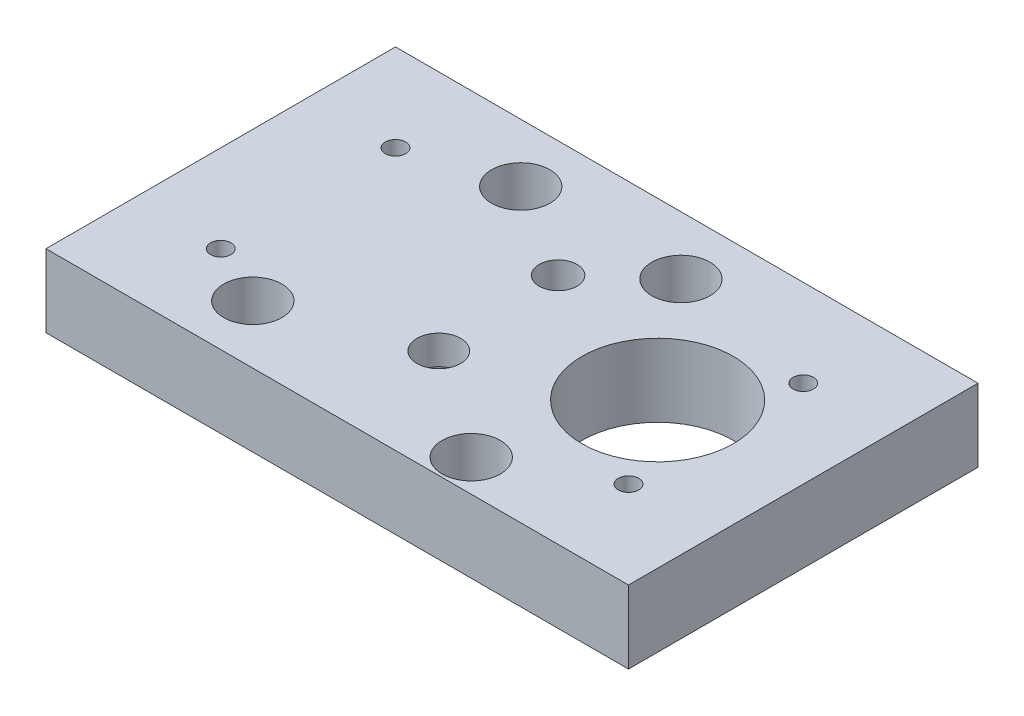
from build123d import *

# Parameters (mm, degrees)
SKETCH_1_W          = 20
SKETCH_1_H          = 12
SKETCH_1_R          = 0.65
SKETCH_1_R_2        = 1.6
SKETCH_1_R_3        = 2.6
EXTRUDE_1_DEPTH     = 2.5
EXTRUDE_START       = 1.5
SKETCH_1_5_R        = 1.6
SKETCH_1_5_R_2      = 0.75
EXTRUDE_2_DEPTH     = 1
SKETCH_3_R          = 0.7
SKETCH_3_R_2        = 0.35
CUT_EXTRUDE_1_DEPTH = 24.457408211
SKETCH_3_3_R        = 1
CUT_EXTRUDE_2_DEPTH = 1.5


with BuildPart() as part:
    # 草图1 → 凸台-拉伸1 (new body)
    with BuildSketch(Plane(origin=(0, 0, 0), x_dir=(1, 0, 0), z_dir=(0, 1, 0))):
        with Locations((10, -6)):
            Rectangle(SKETCH_1_W, SKETCH_1_H)
        with Locations(Location((9.582575695, -4, 0), (0, 0, 270))):
            Circle(SKETCH_1_R, mode=Mode.SUBTRACT)
        with Locations(Location((9.782588007, -8.295345746, 0), (0, 0, 270))):
            Circle(SKETCH_1_R_2, mode=Mode.SUBTRACT)
        with Locations(Location((15, -6, 0), (0, 0, 270))):
            Circle(SKETCH_1_R_3, mode=Mode.SUBTRACT)
    extrude(amount=EXTRUDE_1_DEPTH)

    # 草图1<5> → 凸台-拉伸2 (add)
    with BuildSketch(Plane(origin=(0, 0, 0), x_dir=(1, 0, 0), z_dir=(0, 1, 0)).offset(EXTRUDE_START)):
        with Locations(Location((9.782588007, -8.295345746, 0), (0, 0, 90))):
            Circle(SKETCH_1_5_R)
        with Locations(Location((9.782588007, -8.295345746, 0), (0, 0, 90))):
            Circle(SKETCH_1_5_R_2, mode=Mode.SUBTRACT)
    extrude(amount=EXTRUDE_2_DEPTH)

    # 草图3 → 切除-拉伸1 (cut, through all)
    with BuildSketch(Plane(origin=(0, 2.5, 0), x_dir=(1, 0, 0), z_dir=(0, 1, 0))):
        with Locations(Location((5.1, -10, 0), (0, 0, 270))):
            Circle(SKETCH_3_R)
        with Locations(Location((6.3, -2, 0), (0, 0, 270))):
            Circle(SKETCH_3_R)
        with Locations(Location((11.8, -2, 0), (0, 0, 270))):
            Circle(SKETCH_3_R)
        with Locations(Location((13.5, -10.9, 0), (0, 0, 270))):
            Circle(SKETCH_3_R)
        with Locations(Location((3, -3, 0), (0, 0, 270))):
            Circle(SKETCH_3_R_2)
        with Locations(Location((3, -9, 0), (0, 0, 270))):
            Circle(SKETCH_3_R_2)
        with Locations(Location((17, -9, 0), (0, 0, 270))):
            Circle(SKETCH_3_R_2)
        with Locations(Location((17, -3, 0), (0, 0, 270))):
            Circle(SKETCH_3_R_2)
    extrude(amount=-CUT_EXTRUDE_1_DEPTH, mode=Mode.SUBTRACT)

    # 草图3<3> → 切除-拉伸2 (cut)
    with BuildSketch(Plane(origin=(0, 2.5, 0), x_dir=(1, 0, 0), z_dir=(0, 1, 0))):
        with Locations(Location((6.3, -2, 0), (0, 0, 270))):
            Circle(SKETCH_3_3_R)
        with Locations(Location((5.1, -10, 0), (0, 0, 270))):
            Circle(SKETCH_3_3_R)
        with Locations(Location((11.8, -2, 0), (0, 0, 270))):
            Circle(SKETCH_3_3_R)
        with Locations(Location((13.5, -10.9, 0), (0, 0, 270))):
            Circle(SKETCH_3_3_R)
    extrude(amount=-CUT_EXTRUDE_2_DEPTH, mode=Mode.SUBTRACT)


solid = part.part
